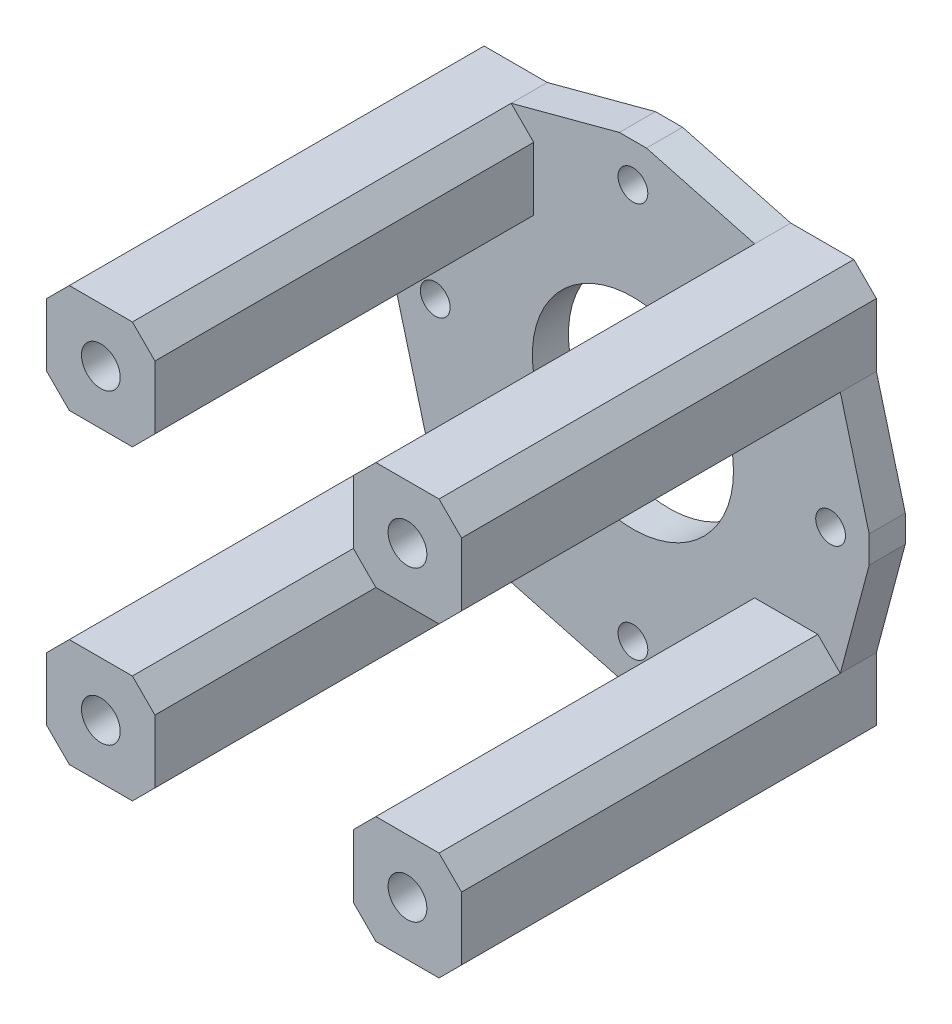
from build123d import *

# Parameters (mm, degrees)
SKETCH1_W           = 50
SKETCH1_H           = 50
SKETCH1_R           = 11.15
SKETCH1_R_2         = 2.15
SKETCH1_R_3         = 1.65
BOSS_EXTRUDE1_DEPTH = 4
BOSS_EXTRUDE2_START = 42
SKETCH2_W           = 12
SKETCH2_H           = 12
SKETCH2_R           = 2.15
BOSS_EXTRUDE2_DEPTH = 42
CHAMFER1_SIZE       = 2.5
CUT_EXTRUDE1_START  = -8
SKETCH3_R           = 4.5
CUT_EXTRUDE1_DEPTH  = 51.017238817
SKETCH5_W           = 56
SKETCH5_H           = 56
CUT_EXTRUDE2_DEPTH  = 55.899908925
BOSS_EXTRUDE3_DEPTH = 4
CIRPATTERN1_COUNT   = 4


with BuildPart() as part:
    # Sketch1 → Boss-Extrude1 (new body)
    with BuildSketch(Plane.XY):
        Rectangle(SKETCH1_W, SKETCH1_H)
        Circle(SKETCH1_R, mode=Mode.SUBTRACT)
        with Locations((-17, 17)):
            Circle(SKETCH1_R_2, mode=Mode.SUBTRACT)
        with Locations((17, 17)):
            Circle(SKETCH1_R_2, mode=Mode.SUBTRACT)
        with Locations((17, -17)):
            Circle(SKETCH1_R_2, mode=Mode.SUBTRACT)
        with Locations((-17, -17)):
            Circle(SKETCH1_R_2, mode=Mode.SUBTRACT)
        with Locations((-21.920310217, 0)):
            Circle(SKETCH1_R_3, mode=Mode.SUBTRACT)
        with Locations((0, 21.920310217)):
            Circle(SKETCH1_R_3, mode=Mode.SUBTRACT)
        with Locations((21.920310217, 0)):
            Circle(SKETCH1_R_3, mode=Mode.SUBTRACT)
        with Locations((0, -21.920310217)):
            Circle(SKETCH1_R_3, mode=Mode.SUBTRACT)
    extrude(amount=-BOSS_EXTRUDE1_DEPTH)

    # Sketch2 → Boss-Extrude2 (add)
    # profile 1 of 4: a face of its own
    with BuildSketch(Plane.XY.offset(BOSS_EXTRUDE2_START)):
        with Locations((-17, 17)):
            Rectangle(SKETCH2_W, SKETCH2_H)
        with Locations((-17, 17)):
            Circle(SKETCH2_R, mode=Mode.SUBTRACT)
    # profile 2 of 4: a face of its own
    with BuildSketch(Plane.XY.offset(BOSS_EXTRUDE2_START)):
        with Locations((17, 17)):
            Rectangle(SKETCH2_W, SKETCH2_H)
        with Locations((17, 17)):
            Circle(SKETCH2_R, mode=Mode.SUBTRACT)
    # profile 3 of 4: a face of its own
    with BuildSketch(Plane.XY.offset(BOSS_EXTRUDE2_START)):
        with Locations((17, -17)):
            Rectangle(SKETCH2_W, SKETCH2_H)
        with Locations((17, -17)):
            Circle(SKETCH2_R, mode=Mode.SUBTRACT)
    # profile 4 of 4: a face of its own
    with BuildSketch(Plane.XY.offset(BOSS_EXTRUDE2_START)):
        with Locations((-17, -17)):
            Rectangle(SKETCH2_W, SKETCH2_H)
        with Locations((-17, -17)):
            Circle(SKETCH2_R, mode=Mode.SUBTRACT)
    extrude(amount=-BOSS_EXTRUDE2_DEPTH)

    # Chamfer1
    chamfer1_edges = [part.edges().sort_by_distance(p)[0] for p in [
        (-23, 23, 21),
        (-23, 11, 21),
        (-11, 11, 21),
        (-11, 23, 21),
        (23, 11, 21),
        (23, 23, 21),
        (11, 23, 21),
        (11, 11, 21),
        (23, -23, 21),
        (23, -11, 21),
        (11, -11, 21),
        (11, -23, 21),
        (-23, -11, 21),
        (-23, -23, 21),
        (-11, -23, 21),
        (-11, -11, 21),
    ]]
    chamfer(chamfer1_edges, length=CHAMFER1_SIZE)

    # Sketch3 → Cut-Extrude1 (cut, through all)
    with BuildSketch(Plane.XY.offset(42).offset(CUT_EXTRUDE1_START)):
        with Locations((-17, 17)):
            Circle(SKETCH3_R)
        with Locations((17, 17)):
            Circle(SKETCH3_R)
        with Locations((17, -17)):
            Circle(SKETCH3_R)
        with Locations((-17, -17)):
            Circle(SKETCH3_R)
    extrude(amount=-CUT_EXTRUDE1_DEPTH, mode=Mode.SUBTRACT)

    # Sketch5 → Cut-Extrude2 (cut, through all)
    with BuildSketch(Plane.XY):
        Rectangle(SKETCH5_W, SKETCH5_H)
        Polygon((-23, 20.5), (-20.5, 23), (-13.5, 23), (-6, 25), (6, 25), (13.5, 23), (20.5, 23), (23, 20.5), (23, 13.5), (25, 6), (25, -6), (23, -13.5), (23, -20.5), (20.5, -23), (13.5, -23), (6, -25), (-6, -25), (-13.5, -23), (-20.5, -23), (-23, -20.5), (-23, -13.5), (-25, -6), (-25, 6), (-23, 13.5), align=None, mode=Mode.SUBTRACT)
    extrude(amount=-CUT_EXTRUDE2_DEPTH, mode=Mode.SUBTRACT)

    # Sketch6 → Boss-Extrude3 (add)
    with BuildSketch(Plane.XY):
        Polygon((-6, 25), (-1.5, 26.2), (1.5, 26.2), (6, 25), align=None)
    boss_extrude3 = extrude(amount=-BOSS_EXTRUDE3_DEPTH)

    # CirPattern1: Boss-Extrude3 ×4 about axis
    cirpattern1_axis = Axis((0, 0, 0), (0, 0, 1))
    for i in range(1, CIRPATTERN1_COUNT):
        add(boss_extrude3.rotate(cirpattern1_axis, i * 360 / CIRPATTERN1_COUNT))


solid = part.part
